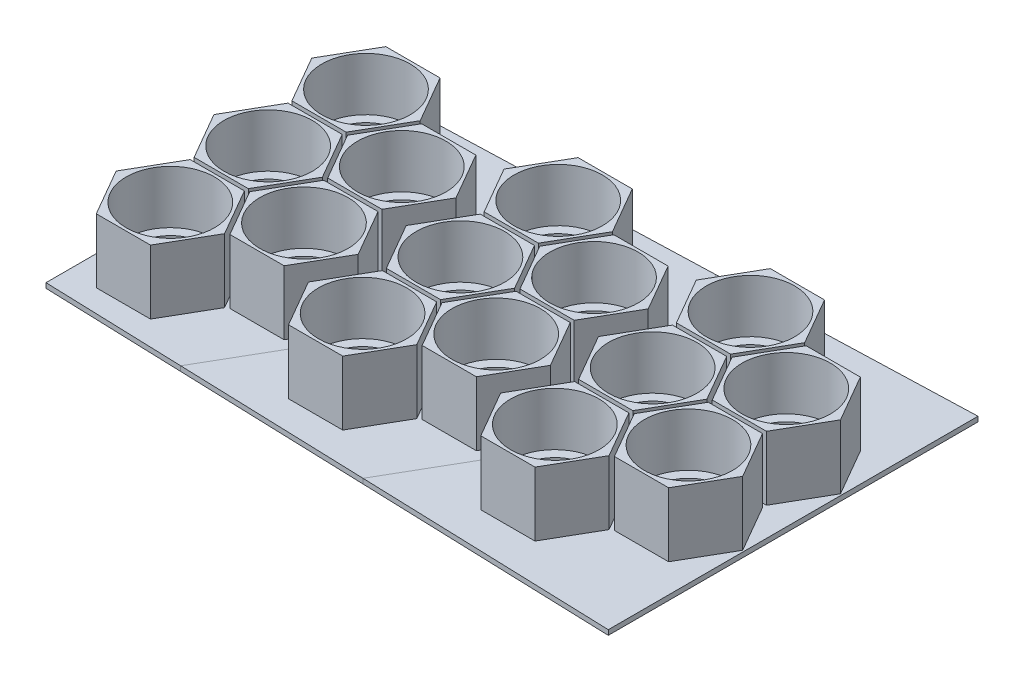
from build123d import *

# Parameters (mm, degrees)
BOSS_EXTRUDE1_DEPTH      = 1
BOSS_EXTRUDE2_DEPTH      = 26
SKETCH4_R                = 13.97
CUT_EXTRUDE1_DEPTH       = 25.4
SKETCH4_4_R              = 17.907
CUT_EXTRUDE2_DEPTH       = 21.55444
LPATTERN1_COUNT          = 3
LPATTERN1_PITCH          = 78
SPLIT3_SURFACE_1_1_BACK  = 282.034
SPLIT3_SURFACE_1_1_DEPTH = 564.068
SPLIT3_SURFACE_1_2_BACK  = 282.034
SPLIT3_SURFACE_1_2_DEPTH = 564.068
SPLIT3_SURFACE_2_3_BACK  = 282.034
SPLIT3_SURFACE_2_3_DEPTH = 564.068
SPLIT3_SURFACE_2_4_BACK  = 282.034
SPLIT3_SURFACE_2_4_DEPTH = 564.068


with BuildPart() as part:
    # Sketch1 → Boss-Extrude1 (new, symmetric)
    with BuildSketch(Plane(origin=(0, 0, 0), x_dir=(1, 0, 0), z_dir=(0, 1, 0))):
        Polygon((-118, 67.135), (-118, -67.135), (118, -75), (118, 75), align=None)
    extrude(amount=BOSS_EXTRUDE1_DEPTH, both=True)

    # Sketch3 → Boss-Extrude2 (add)
    with BuildSketch(Plane(origin=(0, 1, 0), x_dir=(1, 0, 0), z_dir=(0, 1, 0))):
        Polygon((-73.002954744, 39.6875), (-84.001477372, 58.7375), (-105.998522628, 58.7375), (-116.997045256, 39.6875), (-105.998522628, 20.6375), (-84.001477372, 20.6375), align=None)
        Polygon((-73.002954744, 0), (-84.001477372, 19.05), (-105.998522628, 19.05), (-116.997045256, 0), (-105.998522628, -19.05), (-84.001477372, -19.05), align=None)
        Polygon((-84.001477372, -58.7375), (-73.002954744, -39.6875), (-84.001477372, -20.6375), (-105.998522628, -20.6375), (-116.997045256, -39.6875), (-105.998522628, -58.7375), align=None)
        Polygon((-38.632571531, 19.84375), (-49.631094159, 38.89375), (-71.628139415, 38.89375), (-82.626662043, 19.84375), (-71.628139415, 0.79375), (-49.631094159, 0.79375), align=None)
        Polygon((-49.631094159, -38.89375), (-38.632571531, -19.84375), (-49.631094159, -0.79375), (-71.628139415, -0.79375), (-82.626662043, -19.84375), (-71.628139415, -38.89375), align=None)
    boss_extrude2 = extrude(amount=BOSS_EXTRUDE2_DEPTH)

    # Sketch4 → Cut-Extrude1 (cut)
    with BuildSketch(Plane(origin=(0, 27, 0), x_dir=(1, 0, 0), z_dir=(0, 1, 0))):
        with Locations((-95, 0)):
            Circle(SKETCH4_R)
        with Locations((-95, -39.6875)):
            Circle(SKETCH4_R)
        with Locations((-95, 39.6875)):
            Circle(SKETCH4_R)
        with Locations((-60.629616787, 19.84375)):
            Circle(SKETCH4_R)
        with Locations((-60.629616787, -19.84375)):
            Circle(SKETCH4_R)
    cut_extrude1 = extrude(amount=-CUT_EXTRUDE1_DEPTH, mode=Mode.SUBTRACT)

    # Sketch4<4> → Cut-Extrude2 (cut)
    with BuildSketch(Plane(origin=(0, 27, 0), x_dir=(1, 0, 0), z_dir=(0, 1, 0))):
        with Locations((-95, 0)):
            Circle(SKETCH4_4_R)
        with Locations((-95, -39.6875)):
            Circle(SKETCH4_4_R)
        with Locations((-95, 39.6875)):
            Circle(SKETCH4_4_R)
        with Locations((-60.629616787, 19.84375)):
            Circle(SKETCH4_4_R)
        with Locations((-60.629616787, -19.84375)):
            Circle(SKETCH4_4_R)
    cut_extrude2 = extrude(amount=-CUT_EXTRUDE2_DEPTH, mode=Mode.SUBTRACT)

    # LPattern1: Boss-Extrude2, Cut-Extrude1, Cut-Extrude2 ×3
    with Locations(*[(i * LPATTERN1_PITCH, 0, 0) for i in range(1, LPATTERN1_COUNT)]):
        add(boss_extrude2)
        add(cut_extrude1, mode=Mode.SUBTRACT)
        add(cut_extrude2, mode=Mode.SUBTRACT)


with BuildPart() as body_2:
    # Split3: the piece behind the surface
    add(part.part)
    # Split3 surface 1: a surface, the sketch's curves swept straight by 564.068 mm
    with BuildLine(Plane(origin=(0, 1, 0), x_dir=(1, 0, 0), z_dir=(0, 1, 0)).offset(-SPLIT3_SURFACE_1_1_BACK), mode=Mode.PRIVATE) as split3_surface_1_1_path:
        Line((-61.477571296, -69.018681787), (-35.53844397, -24.090795355))
        Line((-35.53844397, -24.090795355), (-33.086411192, -19.84375))
        Line((-33.086411192, -19.84375), (-39.731799052, -8.333600589))
        Line((-39.731799052, -8.333600589), (-44.543205596, 0))
        Line((-44.543205596, 0), (-39.97221259, 7.917192126))
        Line((-39.97221259, 7.917192126), (-33.086411192, 19.84375))
        Line((-33.086411192, 19.84375), (-39.97221259, 31.770307874))
        Line((-39.97221259, 31.770307874), (-61.477571296, 69.018681787))
    split3_surface_1_1 = Shell.extrude(split3_surface_1_1_path.wire(), (0 * SPLIT3_SURFACE_1_1_DEPTH, 1 * SPLIT3_SURFACE_1_1_DEPTH, 0 * SPLIT3_SURFACE_1_1_DEPTH))
    split(bisect_by=split3_surface_1_1, keep=Keep.BOTTOM)


with BuildPart() as part_1:
    add(part.part)

    # Split3: split by a surface, the side it looks to stays
    # Split3 surface 1: a surface, the sketch's curves swept straight by 564.068 mm
    with BuildLine(Plane(origin=(0, 1, 0), x_dir=(1, 0, 0), z_dir=(0, 1, 0)).offset(-SPLIT3_SURFACE_1_2_BACK), mode=Mode.PRIVATE) as split3_surface_1_2_path:
        Line((-61.477571296, -69.018681787), (-35.53844397, -24.090795355))
        Line((-35.53844397, -24.090795355), (-33.086411192, -19.84375))
        Line((-33.086411192, -19.84375), (-39.731799052, -8.333600589))
        Line((-39.731799052, -8.333600589), (-44.543205596, 0))
        Line((-44.543205596, 0), (-39.97221259, 7.917192126))
        Line((-39.97221259, 7.917192126), (-33.086411192, 19.84375))
        Line((-33.086411192, 19.84375), (-39.97221259, 31.770307874))
        Line((-39.97221259, 31.770307874), (-61.477571296, 69.018681787))
    split3_surface_1_2 = Shell.extrude(split3_surface_1_2_path.wire(), (0 * SPLIT3_SURFACE_1_2_DEPTH, 1 * SPLIT3_SURFACE_1_2_DEPTH, 0 * SPLIT3_SURFACE_1_2_DEPTH))
    split(bisect_by=split3_surface_1_2, keep=Keep.TOP)


with BuildPart() as body_3:
    # Split3 2 body 2: the piece behind the surface
    add(body_2.part)
    # Split3 surface 2: a surface, the sketch's curves swept straight by 564.068 mm
    with BuildLine(Plane(origin=(0, 1, 0), x_dir=(1, 0, 0), z_dir=(0, 1, 0)).offset(-SPLIT3_SURFACE_2_3_BACK), mode=Mode.PRIVATE) as split3_surface_2_3_path:
        Line((15.04996756, 71.5690593), (41.969616323, 24.942859921))
        Line((41.969616323, 24.942859921), (44.913588808, 19.84375))
        Line((44.913588808, 19.84375), (38.02778741, 7.917192126))
        Line((38.02778741, 7.917192126), (33.456794404, 0))
        Line((33.456794404, 0), (43.527048724, -17.442192126))
        Line((43.527048724, -17.442192126), (44.913588808, -19.84375))
        Line((44.913588808, -19.84375), (38.02778741, -31.770307874))
        Line((38.02778741, -31.770307874), (15.04996756, -71.5690593))
    split3_surface_2_3 = Shell.extrude(split3_surface_2_3_path.wire(), (0 * SPLIT3_SURFACE_2_3_DEPTH, 1 * SPLIT3_SURFACE_2_3_DEPTH, 0 * SPLIT3_SURFACE_2_3_DEPTH))
    split(bisect_by=split3_surface_2_3, keep=Keep.BOTTOM)


with BuildPart() as body_2_1:
    add(body_2.part)

    # Split3 2 body 2: split by a surface, the side it looks to stays
    # Split3 surface 2: a surface, the sketch's curves swept straight by 564.068 mm
    with BuildLine(Plane(origin=(0, 1, 0), x_dir=(1, 0, 0), z_dir=(0, 1, 0)).offset(-SPLIT3_SURFACE_2_4_BACK), mode=Mode.PRIVATE) as split3_surface_2_4_path:
        Line((15.04996756, 71.5690593), (41.969616323, 24.942859921))
        Line((41.969616323, 24.942859921), (44.913588808, 19.84375))
        Line((44.913588808, 19.84375), (38.02778741, 7.917192126))
        Line((38.02778741, 7.917192126), (33.456794404, 0))
        Line((33.456794404, 0), (43.527048724, -17.442192126))
        Line((43.527048724, -17.442192126), (44.913588808, -19.84375))
        Line((44.913588808, -19.84375), (38.02778741, -31.770307874))
        Line((38.02778741, -31.770307874), (15.04996756, -71.5690593))
    split3_surface_2_4 = Shell.extrude(split3_surface_2_4_path.wire(), (0 * SPLIT3_SURFACE_2_4_DEPTH, 1 * SPLIT3_SURFACE_2_4_DEPTH, 0 * SPLIT3_SURFACE_2_4_DEPTH))
    split(bisect_by=split3_surface_2_4, keep=Keep.TOP)


solid = Compound([part_1.part, body_3.part, body_2_1.part])
